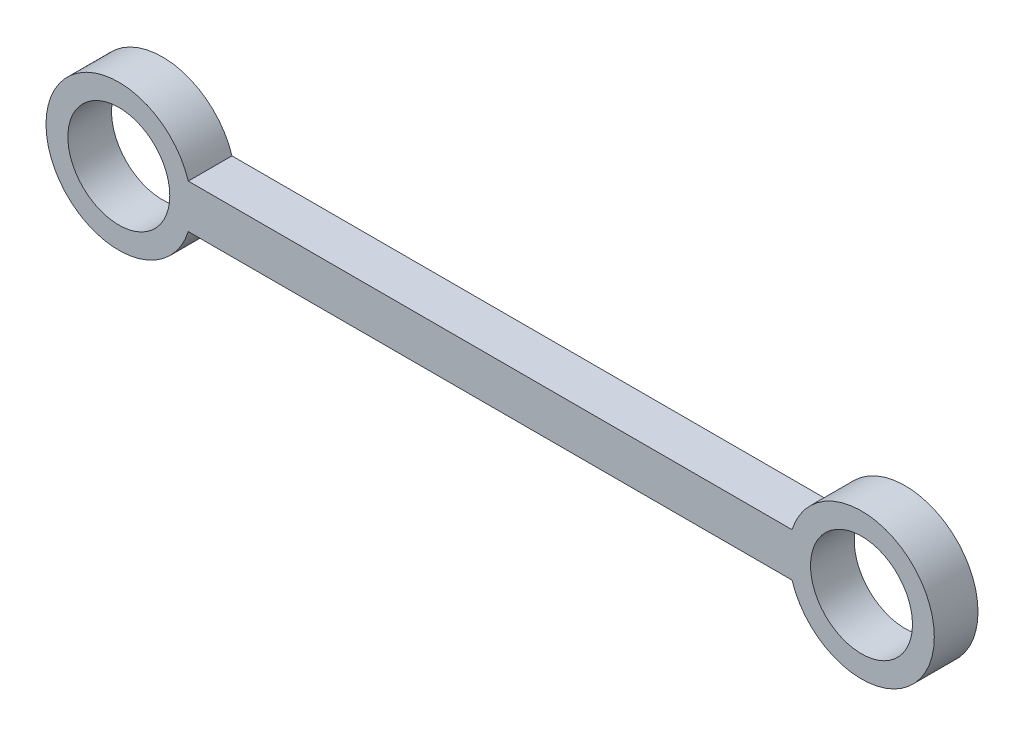
from build123d import *

# Parameters (mm, degrees)
SKETCH1_R           = 1.75
BOSS_EXTRUDE1_DEPTH = 1.5


with BuildPart() as part:
    # Sketch1 → Boss-Extrude1 (new body)
    with BuildSketch(Plane.XY):
        with BuildLine():
            Line((10.365151996, 0.75), (-10.365151996, 0.75))
            ThreePointArc((-10.365151996, 0.75), (-15.25, 0), (-10.365151996, -0.75))
            Line((-10.365151996, -0.75), (10.365151996, -0.75))
            ThreePointArc((10.365151996, -0.75), (15.25, 0), (10.365151996, 0.75))
        make_face()
        with Locations((12.75, 0)):
            Circle(SKETCH1_R, mode=Mode.SUBTRACT)
        with Locations((-12.75, 0)):
            Circle(SKETCH1_R, mode=Mode.SUBTRACT)
    extrude(amount=BOSS_EXTRUDE1_DEPTH)


solid = part.part
